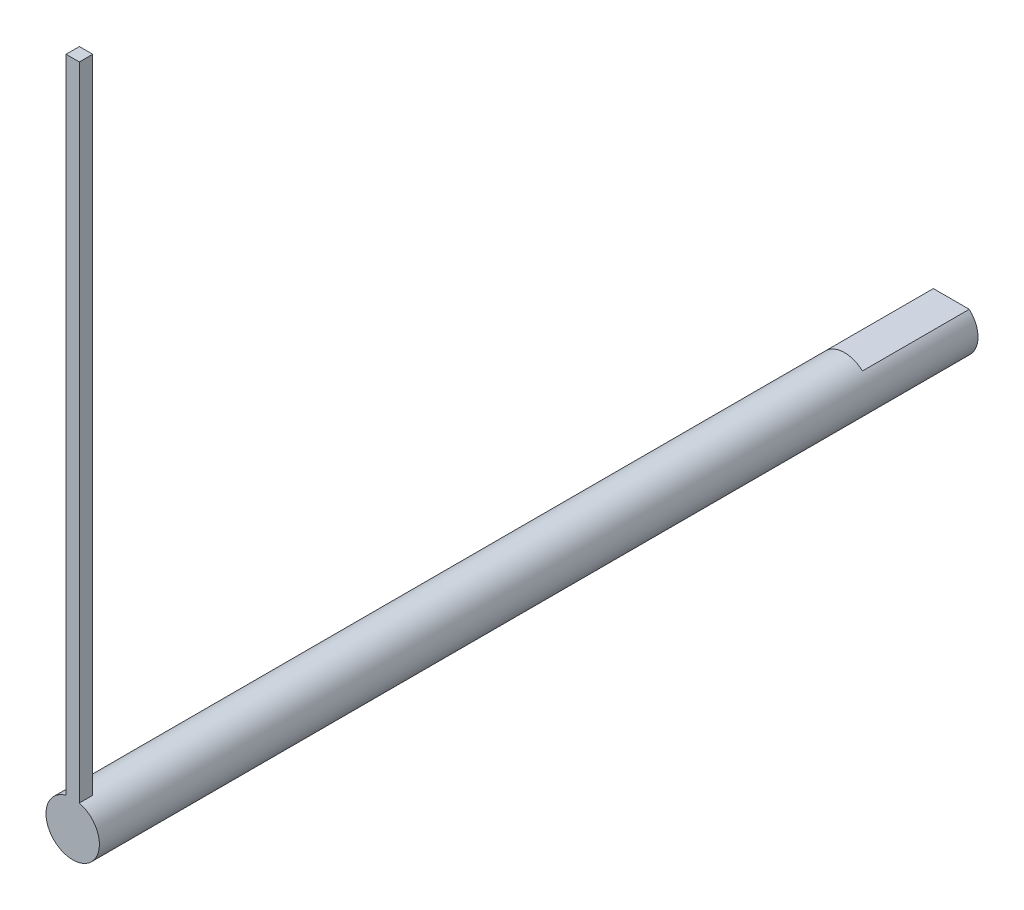
from build123d import *

# Parameters (mm, degrees)
SKETCH1_R           = 2
BOSS_EXTRUDE1_DEPTH = 65.8
CUT_EXTRUDE1_DEPTH  = 8
SKETCH3_W           = 1
SKETCH3_H           = 50
BOSS_EXTRUDE2_DEPTH = 1


with BuildPart() as part:
    # Sketch1 → Boss-Extrude1 (new body)
    with BuildSketch(Plane.XY):
        Circle(SKETCH1_R)
    extrude(amount=BOSS_EXTRUDE1_DEPTH)

    # Sketch2 → Cut-Extrude1 (cut)
    with BuildSketch(Plane(origin=(0, 0, 0), x_dir=(-1, 0, 0), z_dir=(0, 0, -1))):
        with BuildLine():
            Line((-1.345213738, 1.48), (1.345213738, 1.48))
            ThreePointArc((1.345213738, 1.48), (0, 2), (-1.345213738, 1.48))
        make_face()
    extrude(amount=-CUT_EXTRUDE1_DEPTH, mode=Mode.SUBTRACT)

    # Sketch3 → Boss-Extrude2 (add)
    with BuildSketch(Plane.XY.offset(65.8)):
        with Locations((0, 25)):
            Rectangle(SKETCH3_W, SKETCH3_H)
    extrude(amount=-BOSS_EXTRUDE2_DEPTH)


solid = part.part
